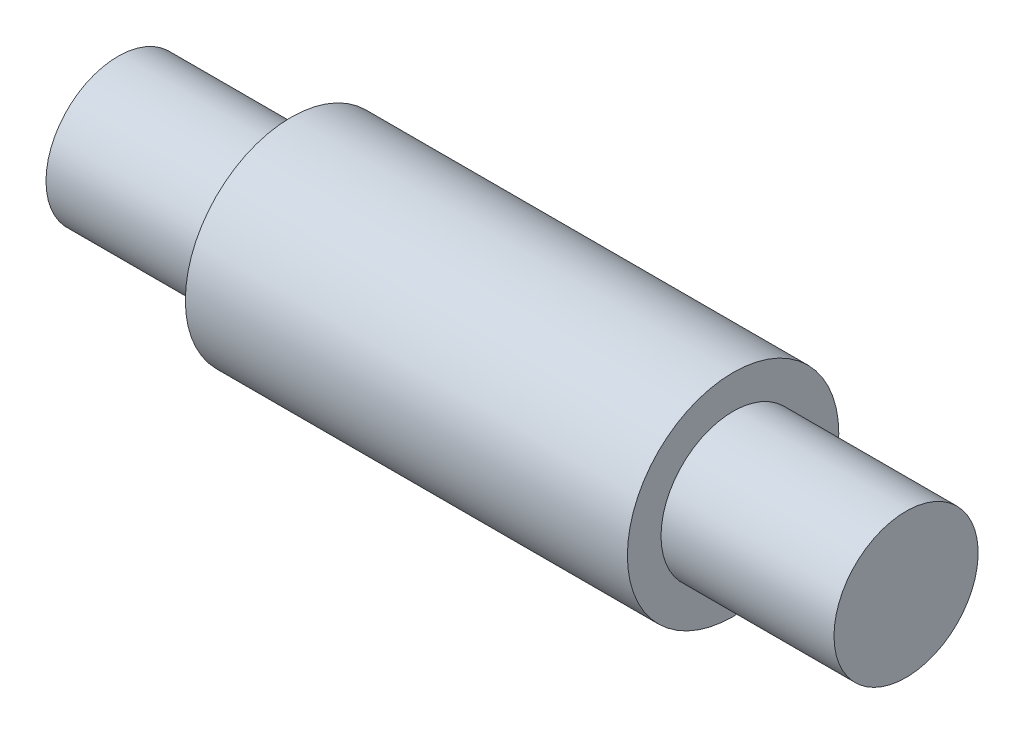
from build123d import *


with BuildPart() as part:
    # Sketch1 → Revolve1 (revolve)
    with BuildSketch(Plane.XY, mode=Mode.PRIVATE) as revolve1_sk:
        Polygon((-59.345021161, 0), (22.654978839, 0), (22.654978839, 7.5), (4.654978839, 7.5), (4.654978839, 11), (-41.345021161, 11), (-41.345021161, 7.5), (-59.345021161, 7.5), align=None)
    revolve(revolve1_sk.sketch.rotate(Axis((-59.345021161, 0, 0), (1, 0, 0)), 90), axis=Axis((-59.345021161, 0, 0), (1, 0, 0)))


solid = part.part
